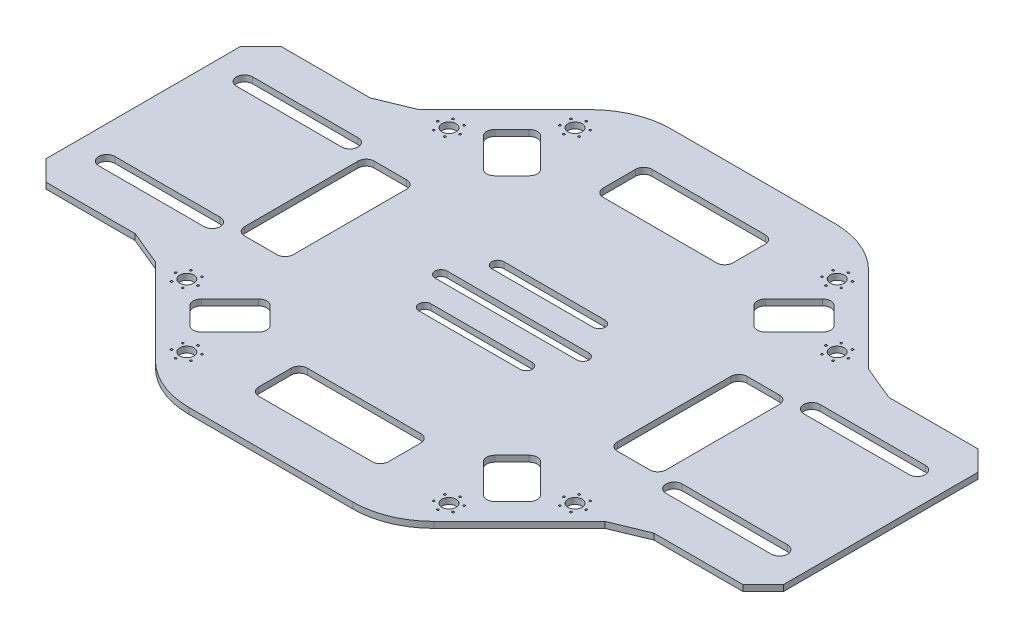
from build123d import *

# Parameters (mm, degrees)
BOSS_EXTRUDE1_DEPTH = 1.5
CHAMFER1_SIZE       = 5
FILLET1_R           = 20
CHAMFER2_SIZE       = 5
SKETCH3_R           = 1.75
CUT_EXTRUDE1_DEPTH  = 109.735918629
SKETCH4_W           = 32
SKETCH4_H           = 12
SKETCH4_W_2         = 12
SKETCH4_H_2         = 32
CUT_EXTRUDE2_DEPTH  = 1.5
FILLET2_R           = 2
CUT_EXTRUDE3_DEPTH  = 1.5
SKETCH6_R           = 0.25
CUT_EXTRUDE4_DEPTH  = 1.5


with BuildPart() as part:
    # Sketch1 → Boss-Extrude1 (new body)
    with BuildSketch(Plane(origin=(0, 0, 0), x_dir=(1, 0, 0), z_dir=(0, 1, 0))):
        Polygon((28.5, 59.5), (-28.5, 59.5), (-59, 29), (-91, 29), (-91, -29), (-59, -29), (-28.5, -59.5), (28.5, -59.5), (59, -29), (91, -29), (91, 29), (59, 29), align=None)
    extrude(amount=BOSS_EXTRUDE1_DEPTH)

    # Chamfer1
    chamfer1_edges = [part.edges().sort_by_distance(p)[0] for p in [
        (91, 0.75, -29),
        (91, 0.75, 29),
        (-91, 0.75, 29),
        (-91, 0.75, -29),
    ]]
    chamfer(chamfer1_edges, length=CHAMFER1_SIZE)

    # Fillet1
    fillet1_edges = [part.edges().sort_by_distance(p)[0] for p in [
        (-28.5, 0.75, -59.5),
        (28.5, 0.75, -59.5),
        (28.5, 0.75, 59.5),
        (-28.5, 0.75, 59.5),
    ]]
    fillet(fillet1_edges, radius=FILLET1_R)

    # Chamfer2
    chamfer2_edges = [part.edges().sort_by_distance(p)[0] for p in [
        (59, 0.75, -29),
        (59, 0.75, 29),
        (-59, 0.75, 29),
        (-59, 0.75, -29),
    ]]
    chamfer(chamfer2_edges, length=CHAMFER2_SIZE)

    # Sketch3 → Cut-Extrude1 (cut, through all)
    with BuildSketch(Plane(origin=(0, 1.5, 0), x_dir=(1, 0, 0), z_dir=(0, 1, 0))):
        with Locations(Location((-32.350135239, 47.906484425, 0), (0, 0, 270))):
            Circle(SKETCH3_R)
        with Locations(Location((-47.906484425, 32.350135239, 0), (0, 0, 90))):
            Circle(SKETCH3_R)
        with Locations(Location((32.350135239, 47.906484425, 0), (0, 0, 90))):
            Circle(SKETCH3_R)
        with Locations(Location((47.906484425, 32.350135239, 0), (0, 0, 270))):
            Circle(SKETCH3_R)
        with Locations(Location((47.906484425, -32.350135239, 0), (0, 0, 90))):
            Circle(SKETCH3_R)
        with Locations(Location((32.350135239, -47.906484425, 0), (0, 0, 270))):
            Circle(SKETCH3_R)
        with Locations(Location((-32.350135239, -47.906484425, 0), (0, 0, 90))):
            Circle(SKETCH3_R)
        with Locations(Location((-47.906484425, -32.350135239, 0), (0, 0, 270))):
            Circle(SKETCH3_R)
    extrude(amount=-CUT_EXTRUDE1_DEPTH, mode=Mode.SUBTRACT)

    # Sketch4 → Cut-Extrude2 (cut)
    with BuildSketch(Plane(origin=(0, 1.5, 0), x_dir=(1, 0, 0), z_dir=(0, 1, 0))):
        with BuildLine():
            Line((57, 19), (83, 19))
            ThreePointArc((83, 19), (85, 17), (83, 15))
            Line((83, 15), (57, 15))
            ThreePointArc((57, 15), (55, 17), (57, 19))
        make_face()
        with BuildLine():
            Line((-17.5, 1.5), (17.5, 1.5))
            ThreePointArc((17.5, 1.5), (19, 0), (17.5, -1.5))
            Line((17.5, -1.5), (-17.5, -1.5))
            ThreePointArc((-17.5, -1.5), (-19, 0), (-17.5, 1.5))
        make_face()
        with BuildLine():
            Line((-12.5, 10.5), (12.5, 10.5))
            ThreePointArc((12.5, 10.5), (14, 9), (12.5, 7.5))
            Line((12.5, 7.5), (-12.5, 7.5))
            ThreePointArc((-12.5, 7.5), (-14, 9), (-12.5, 10.5))
        make_face()
        with Locations((0, 42.5)):
            Rectangle(SKETCH4_W, SKETCH4_H)
        with Locations((46, 0)):
            Rectangle(SKETCH4_W_2, SKETCH4_H_2)
        with BuildLine():
            Line((57, -19), (83, -19))
            ThreePointArc((83, -19), (85, -17), (83, -15))
            Line((83, -15), (57, -15))
            ThreePointArc((57, -15), (55, -17), (57, -19))
        make_face()
        with BuildLine():
            Line((-12.5, -10.5), (12.5, -10.5))
            ThreePointArc((12.5, -10.5), (14, -9), (12.5, -7.5))
            Line((12.5, -7.5), (-12.5, -7.5))
            ThreePointArc((-12.5, -7.5), (-14, -9), (-12.5, -10.5))
        make_face()
        with Locations((-46, 0)):
            Rectangle(SKETCH4_W_2, SKETCH4_H_2)
        with BuildLine():
            Line((-57, -19), (-83, -19))
            ThreePointArc((-83, -19), (-85, -17), (-83, -15))
            Line((-83, -15), (-57, -15))
            ThreePointArc((-57, -15), (-55, -17), (-57, -19))
        make_face()
        with BuildLine():
            Line((-57, 19), (-83, 19))
            ThreePointArc((-83, 19), (-85, 17), (-83, 15))
            Line((-83, 15), (-57, 15))
            ThreePointArc((-57, 15), (-55, 17), (-57, 19))
        make_face()
        with Locations((0, -42.5)):
            Rectangle(SKETCH4_W, SKETCH4_H)
    extrude(amount=-CUT_EXTRUDE2_DEPTH, mode=Mode.SUBTRACT)

    # Fillet2
    fillet2_edges = [part.edges().sort_by_distance(p)[0] for p in [
        (-40, 0.75, -16),
        (-40, 0.75, 16),
        (-52, 0.75, 16),
        (-52, 0.75, -16),
        (-16, 0.75, -36.5),
        (-16, 0.75, -48.5),
        (16, 0.75, -48.5),
        (16, 0.75, -36.5),
        (40, 0.75, 16),
        (40, 0.75, -16),
        (52, 0.75, -16),
        (52, 0.75, 16),
        (16, 0.75, 48.5),
        (-16, 0.75, 48.5),
        (-16, 0.75, 36.5),
        (16, 0.75, 36.5),
    ]]
    fillet(fillet2_edges, radius=FILLET2_R)

    # Sketch5 → Cut-Extrude3 (cut)
    with BuildSketch(Plane(origin=(0, 1.5, 0), x_dir=(1, 0, 0), z_dir=(0, 1, 0))):
        with BuildLine():
            Line((-41.878679656, 37.636038969), (-37.636038969, 41.878679656))
            ThreePointArc((-37.636038969, 41.878679656), (-36.221825407, 42.464466094), (-34.807611845, 41.878679656))
            Line((-34.807611845, 41.878679656), (-27.736544033, 34.807611845))
            ThreePointArc((-27.736544033, 34.807611845), (-27.150757595, 33.393398282), (-27.736544033, 31.97918472))
            Line((-27.736544033, 31.97918472), (-31.97918472, 27.736544033))
            ThreePointArc((-31.97918472, 27.736544033), (-33.393398282, 27.150757595), (-34.807611845, 27.736544033))
            Line((-34.807611845, 27.736544033), (-41.878679656, 34.807611845))
            ThreePointArc((-41.878679656, 34.807611845), (-42.464466094, 36.221825407), (-41.878679656, 37.636038969))
        make_face()
        with BuildLine():
            Line((31.97918472, 27.736544033), (27.736544033, 31.97918472))
            ThreePointArc((27.736544033, 31.97918472), (27.150757595, 33.393398282), (27.736544033, 34.807611845))
            Line((27.736544033, 34.807611845), (34.807611845, 41.878679656))
            ThreePointArc((34.807611845, 41.878679656), (36.221825407, 42.464466094), (37.636038969, 41.878679656))
            Line((37.636038969, 41.878679656), (41.878679656, 37.636038969))
            ThreePointArc((41.878679656, 37.636038969), (42.464466094, 36.221825407), (41.878679656, 34.807611845))
            Line((41.878679656, 34.807611845), (34.807611845, 27.736544033))
            ThreePointArc((34.807611845, 27.736544033), (33.393398282, 27.150757595), (31.97918472, 27.736544033))
        make_face()
        with BuildLine():
            Line((27.736544033, -31.97918472), (31.97918472, -27.736544033))
            ThreePointArc((31.97918472, -27.736544033), (33.393398282, -27.150757595), (34.807611845, -27.736544033))
            Line((34.807611845, -27.736544033), (41.878679656, -34.807611845))
            ThreePointArc((41.878679656, -34.807611845), (42.464466094, -36.221825407), (41.878679656, -37.636038969))
            Line((41.878679656, -37.636038969), (37.636038969, -41.878679656))
            ThreePointArc((37.636038969, -41.878679656), (36.221825407, -42.464466094), (34.807611845, -41.878679656))
            Line((34.807611845, -41.878679656), (27.736544033, -34.807611845))
            ThreePointArc((27.736544033, -34.807611845), (27.150757595, -33.393398282), (27.736544033, -31.97918472))
        make_face()
        with BuildLine():
            Line((-31.97918472, -27.736544033), (-27.736544033, -31.97918472))
            ThreePointArc((-27.736544033, -31.97918472), (-27.150757595, -33.393398282), (-27.736544033, -34.807611845))
            Line((-27.736544033, -34.807611845), (-34.807611845, -41.878679656))
            ThreePointArc((-34.807611845, -41.878679656), (-36.221825407, -42.464466094), (-37.636038969, -41.878679656))
            Line((-37.636038969, -41.878679656), (-41.878679656, -37.636038969))
            ThreePointArc((-41.878679656, -37.636038969), (-42.464466094, -36.221825407), (-41.878679656, -34.807611845))
            Line((-41.878679656, -34.807611845), (-34.807611845, -27.736544033))
            ThreePointArc((-34.807611845, -27.736544033), (-33.393398282, -27.150757595), (-31.97918472, -27.736544033))
        make_face()
    extrude(amount=-CUT_EXTRUDE3_DEPTH, mode=Mode.SUBTRACT)

    # Sketch6 → Cut-Extrude4 (cut)
    with BuildSketch(Plane(origin=(0, 1.5, 0), x_dir=(1, 0, 0), z_dir=(0, 1, 0))):
        with Locations(Location((-32.350135239, 50.656484425, 0), (0, 0, 270))):
            Circle(SKETCH6_R)
        with Locations(Location((-29.968565379, 49.281484425, 0), (0, 0, 270))):
            Circle(SKETCH6_R)
        with Locations(Location((-29.968565379, 46.531484425, 0), (0, 0, 270))):
            Circle(SKETCH6_R)
        with Locations(Location((-32.350135239, 45.156484425, 0), (0, 0, 270))):
            Circle(SKETCH6_R)
        with Locations(Location((-34.7317051, 46.531484425, 0), (0, 0, 270))):
            Circle(SKETCH6_R)
        with Locations(Location((-34.7317051, 49.281484425, 0), (0, 0, 270))):
            Circle(SKETCH6_R)
        with Locations(Location((-49.281484425, 34.7317051, 0), (0, 0, 90))):
            Circle(SKETCH6_R)
        with Locations(Location((-46.531484425, 34.7317051, 0), (0, 0, 90))):
            Circle(SKETCH6_R)
        with Locations(Location((-45.156484425, 32.350135239, 0), (0, 0, 90))):
            Circle(SKETCH6_R)
        with Locations(Location((-46.531484425, 29.968565379, 0), (0, 0, 90))):
            Circle(SKETCH6_R)
        with Locations(Location((-49.281484425, 29.968565379, 0), (0, 0, 90))):
            Circle(SKETCH6_R)
        with Locations(Location((-50.656484425, 32.350135239, 0), (0, 0, 90))):
            Circle(SKETCH6_R)
        with Locations(Location((-50.656484425, -32.350135239, 0), (0, 0, 270))):
            Circle(SKETCH6_R)
        with Locations(Location((-49.281484425, -29.968565379, 0), (0, 0, 270))):
            Circle(SKETCH6_R)
        with Locations(Location((-46.531484425, -29.968565379, 0), (0, 0, 270))):
            Circle(SKETCH6_R)
        with Locations(Location((-45.156484425, -32.350135239, 0), (0, 0, 270))):
            Circle(SKETCH6_R)
        with Locations(Location((-46.531484425, -34.7317051, 0), (0, 0, 270))):
            Circle(SKETCH6_R)
        with Locations(Location((-49.281484425, -34.7317051, 0), (0, 0, 270))):
            Circle(SKETCH6_R)
        with Locations(Location((-34.7317051, -46.531484425, 0), (0, 0, 90))):
            Circle(SKETCH6_R)
        with Locations(Location((-32.350135239, -45.156484425, 0), (0, 0, 90))):
            Circle(SKETCH6_R)
        with Locations(Location((-29.968565379, -46.531484425, 0), (0, 0, 90))):
            Circle(SKETCH6_R)
        with Locations(Location((-29.968565379, -49.281484425, 0), (0, 0, 90))):
            Circle(SKETCH6_R)
        with Locations(Location((-32.350135239, -50.656484425, 0), (0, 0, 90))):
            Circle(SKETCH6_R)
        with Locations(Location((-34.7317051, -49.281484425, 0), (0, 0, 90))):
            Circle(SKETCH6_R)
        with Locations(Location((32.350135239, -50.656484425, 0), (0, 0, 270))):
            Circle(SKETCH6_R)
        with Locations(Location((29.968565379, -49.281484425, 0), (0, 0, 270))):
            Circle(SKETCH6_R)
        with Locations(Location((29.968565379, -46.531484425, 0), (0, 0, 270))):
            Circle(SKETCH6_R)
        with Locations(Location((32.350135239, -45.156484425, 0), (0, 0, 270))):
            Circle(SKETCH6_R)
        with Locations(Location((34.7317051, -46.531484425, 0), (0, 0, 270))):
            Circle(SKETCH6_R)
        with Locations(Location((34.7317051, -49.281484425, 0), (0, 0, 270))):
            Circle(SKETCH6_R)
        with Locations(Location((46.531484425, -34.7317051, 0), (0, 0, 90))):
            Circle(SKETCH6_R)
        with Locations(Location((45.156484425, -32.350135239, 0), (0, 0, 90))):
            Circle(SKETCH6_R)
        with Locations(Location((46.531484425, -29.968565379, 0), (0, 0, 90))):
            Circle(SKETCH6_R)
        with Locations(Location((49.281484425, -29.968565379, 0), (0, 0, 90))):
            Circle(SKETCH6_R)
        with Locations(Location((50.656484425, -32.350135239, 0), (0, 0, 90))):
            Circle(SKETCH6_R)
        with Locations(Location((49.281484425, -34.7317051, 0), (0, 0, 90))):
            Circle(SKETCH6_R)
        with Locations(Location((50.656484425, 32.350135239, 0), (0, 0, 270))):
            Circle(SKETCH6_R)
        with Locations(Location((49.281484425, 29.968565379, 0), (0, 0, 270))):
            Circle(SKETCH6_R)
        with Locations(Location((46.531484425, 29.968565379, 0), (0, 0, 270))):
            Circle(SKETCH6_R)
        with Locations(Location((45.156484425, 32.350135239, 0), (0, 0, 270))):
            Circle(SKETCH6_R)
        with Locations(Location((46.531484425, 34.7317051, 0), (0, 0, 270))):
            Circle(SKETCH6_R)
        with Locations(Location((49.281484425, 34.7317051, 0), (0, 0, 270))):
            Circle(SKETCH6_R)
        with Locations(Location((34.7317051, 46.531484425, 0), (0, 0, 90))):
            Circle(SKETCH6_R)
        with Locations(Location((32.350135239, 45.156484425, 0), (0, 0, 90))):
            Circle(SKETCH6_R)
        with Locations(Location((29.968565379, 46.531484425, 0), (0, 0, 90))):
            Circle(SKETCH6_R)
        with Locations(Location((29.968565379, 49.281484425, 0), (0, 0, 90))):
            Circle(SKETCH6_R)
        with Locations(Location((32.350135239, 50.656484425, 0), (0, 0, 90))):
            Circle(SKETCH6_R)
        with Locations(Location((34.7317051, 49.281484425, 0), (0, 0, 90))):
            Circle(SKETCH6_R)
    extrude(amount=-CUT_EXTRUDE4_DEPTH, mode=Mode.SUBTRACT)


solid = part.part
